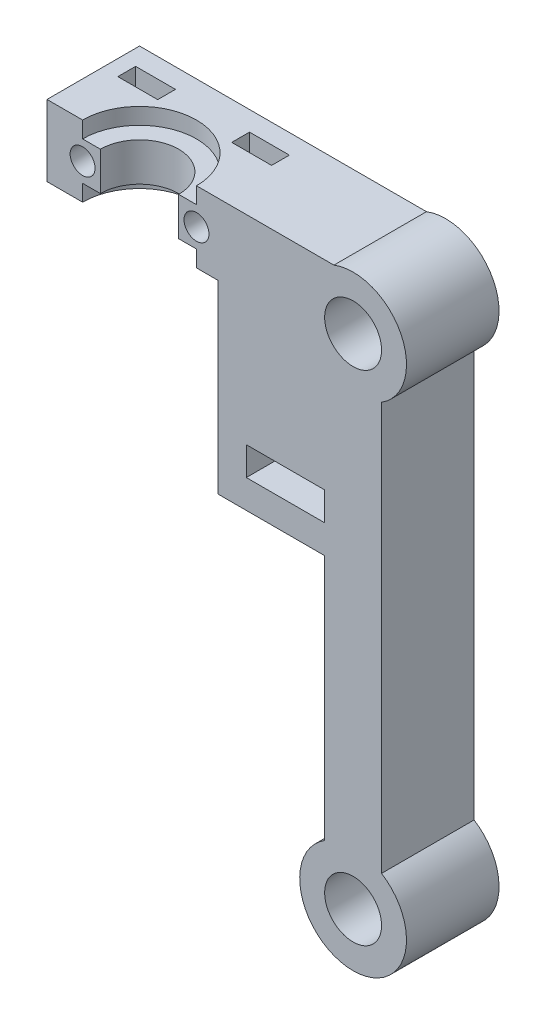
from build123d import *

# Parameters (mm, degrees)
ESBO_O1_R                = 4
ESBO_O1_W                = 11
ESBO_O1_H                = 4
RESSALTO_EXTRUS_O1_DEPTH = 13
RESSALTO_EXTRUS_O3_START = -36
RESSALTO_EXTRUS_O3_DEPTH = 10
CORTE_EXTRUS_O2_START    = -10
ESBO_O7_R                = 8
CORTE_EXTRUS_O2_DEPTH    = 2.3
CORTE_EXTRUS_O3_START    = -2.3
ESBO_O7_2_R              = 8
CORTE_EXTRUS_O3_DEPTH    = 2.3
ESBO_O8_W                = 5.6
ESBO_O8_H                = 2.5
CORTE_EXTRUS_O4_DEPTH    = 10
ESBO_O9_R                = 1.75
CORTE_EXTRUS_O5_DEPTH    = 90.578178146


with BuildPart() as part:
    # Esboço1 → Ressalto-extrusão1 (new body)
    with BuildSketch(Plane.XY):
        with BuildLine():
            Line((4, 63.65571123), (4, 6.34428877))
            ThreePointArc((4, 6.34428877), (0, -7.5), (-4, 6.34428877))
            Line((-4, 6.34428877), (-4, 41))
            Line((-4, 41), (-19, 41))
            Line((-19, 41), (-19, 53))
            Line((-19, 53), (-19, 77))
            Line((-19, 77), (-2.692582404, 77))
            ThreePointArc((-2.692582404, 77), (6.704091727, 73.362313803), (4, 63.65571123))
        make_face()
        with Locations((0, 70)):
            Circle(ESBO_O1_R, mode=Mode.SUBTRACT)
        Circle(ESBO_O1_R, mode=Mode.SUBTRACT)
        with Locations((-9.5, 47)):
            Rectangle(ESBO_O1_W, ESBO_O1_H, mode=Mode.SUBTRACT)
    extrude(amount=RESSALTO_EXTRUS_O1_DEPTH)

    # Esboço5 → Ressalto-extrusão3 (add)
    with BuildSketch(Plane.XZ.offset(-41).offset(RESSALTO_EXTRUS_O3_START)):
        with BuildLine():
            Line((-21, 13), (-19, 13))
            Line((-19, 13), (-19, 0))
            Line((-19, 0), (-43, 0))
            Line((-43, 0), (-43, 13))
            Line((-43, 13), (-35.5, 13))
            ThreePointArc((-35.5, 13), (-30, 7.5), (-24.5, 13))
            Line((-24.5, 13), (-21, 13))
        make_face()
    extrude(amount=RESSALTO_EXTRUS_O3_DEPTH)

    # Esboço7 → Corte-extrusão2 (cut)
    with BuildSketch(Plane(origin=(0, 77, 0), x_dir=(1, 0, 0), z_dir=(0, 1, 0)).offset(CORTE_EXTRUS_O2_START)):
        with Locations((-30, -13)):
            Circle(ESBO_O7_R)
    extrude(amount=CORTE_EXTRUS_O2_DEPTH, mode=Mode.SUBTRACT)

    # Esboço7<2> → Corte-extrusão3 (cut)
    with BuildSketch(Plane(origin=(0, 77, 0), x_dir=(1, 0, 0), z_dir=(0, 1, 0)).offset(CORTE_EXTRUS_O3_START)):
        with Locations((-30, -13)):
            Circle(ESBO_O7_2_R)
    extrude(amount=CORTE_EXTRUS_O3_DEPTH, mode=Mode.SUBTRACT)

    # Esboço8 → Corte-extrusão4 (cut)
    with BuildSketch(Plane(origin=(0, 77, 0), x_dir=(1, 0, 0), z_dir=(0, 1, 0))):
        with Locations((-38, -4)):
            Rectangle(ESBO_O8_W, ESBO_O8_H)
        with Locations((-22, -4)):
            Rectangle(ESBO_O8_W, ESBO_O8_H)
    extrude(amount=-CORTE_EXTRUS_O4_DEPTH, mode=Mode.SUBTRACT)

    # Esboço9 → Corte-extrusão5 (cut, through all)
    with BuildSketch(Plane.XY.offset(13)):
        with Locations((-38, 72)):
            Circle(ESBO_O9_R)
        with Locations((-22, 72)):
            Circle(ESBO_O9_R)
    extrude(amount=-CORTE_EXTRUS_O5_DEPTH, mode=Mode.SUBTRACT)


solid = part.part
